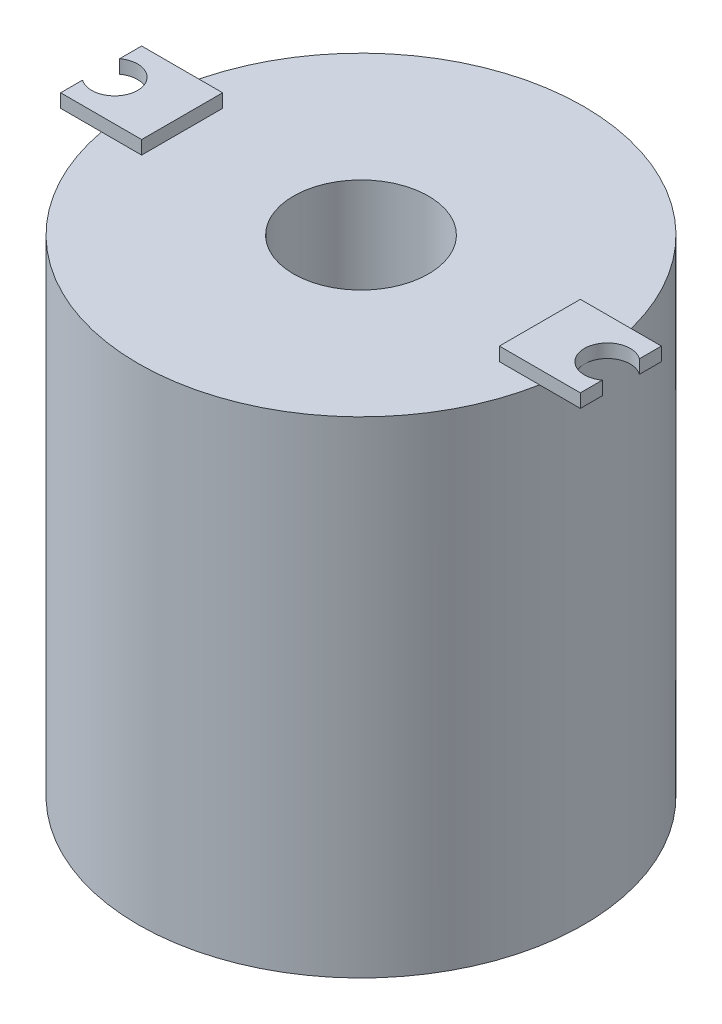
from build123d import *

# Parameters (mm, degrees)
SKETCH1_R            = 16.5
SKETCH1_R_2          = 5
BOSS_EXTRUDE1_DEPTH  = 36
SKETCH2_W            = 6
SKETCH2_H            = 6
BOSS_EXTRUDE2_DEPTH  = 1
M3_CLEARANCE_HOLE1_D = 3.4


with BuildPart() as part:
    # Sketch1 → Boss-Extrude1 (new body)
    with BuildSketch(Plane(origin=(0, 0, 0), x_dir=(1, 0, 0), z_dir=(0, 1, 0))):
        with Locations(Location((0, 0, 0), (0, 0, 270))):
            Circle(SKETCH1_R)
        with Locations(Location((0, 0, 0), (0, 0, 270))):
            Circle(SKETCH1_R_2, mode=Mode.SUBTRACT)
    extrude(amount=BOSS_EXTRUDE1_DEPTH)

    # Sketch2 → Boss-Extrude2 (add)
    with BuildSketch(Plane(origin=(0, 36, 0), x_dir=(1, 0, 0), z_dir=(0, 1, 0))):
        with Locations((16.25, 0)):
            Rectangle(SKETCH2_W, SKETCH2_H)
    boss_extrude2 = extrude(amount=BOSS_EXTRUDE2_DEPTH)

    # M3 Clearance Hole1 (through all)
    with Locations(Plane(origin=(0, 37, 0), x_dir=(1, 0, 0), z_dir=(0, 1, 0))):
        with Locations((18.25, 0)):
            m3_clearance_hole1 = Hole(M3_CLEARANCE_HOLE1_D / 2)

    # Mirror1: Boss-Extrude2, M3 Clearance Hole1 across plane
    add(boss_extrude2.mirror(Plane(origin=(0, 0, 0), x_dir=(0, 0, 1), z_dir=(1, 0, 0))))
    add(m3_clearance_hole1.mirror(Plane(origin=(0, 0, 0), x_dir=(0, 0, 1), z_dir=(1, 0, 0))), mode=Mode.SUBTRACT)


solid = part.part
